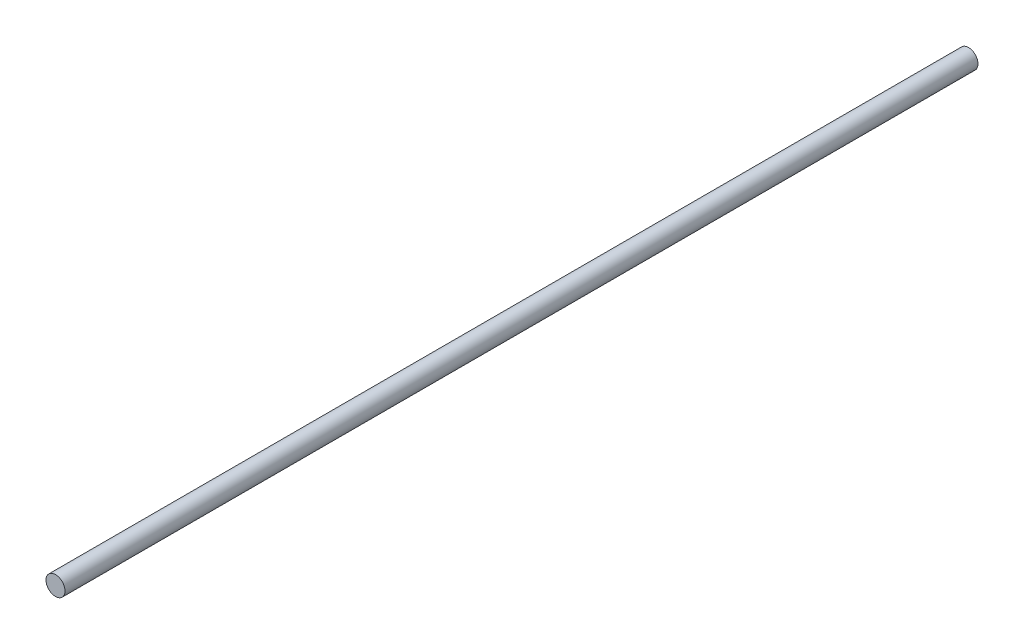
from build123d import *

# Parameters (mm, degrees)
ESQUISSE1_R      = 5
EXTRUSION1_DEPTH = 480


with BuildPart() as part:
    # Esquisse1 → Extrusion1 (new body)
    with BuildSketch(Plane.XY):
        Circle(ESQUISSE1_R)
    extrude(amount=EXTRUSION1_DEPTH)


solid = part.part
